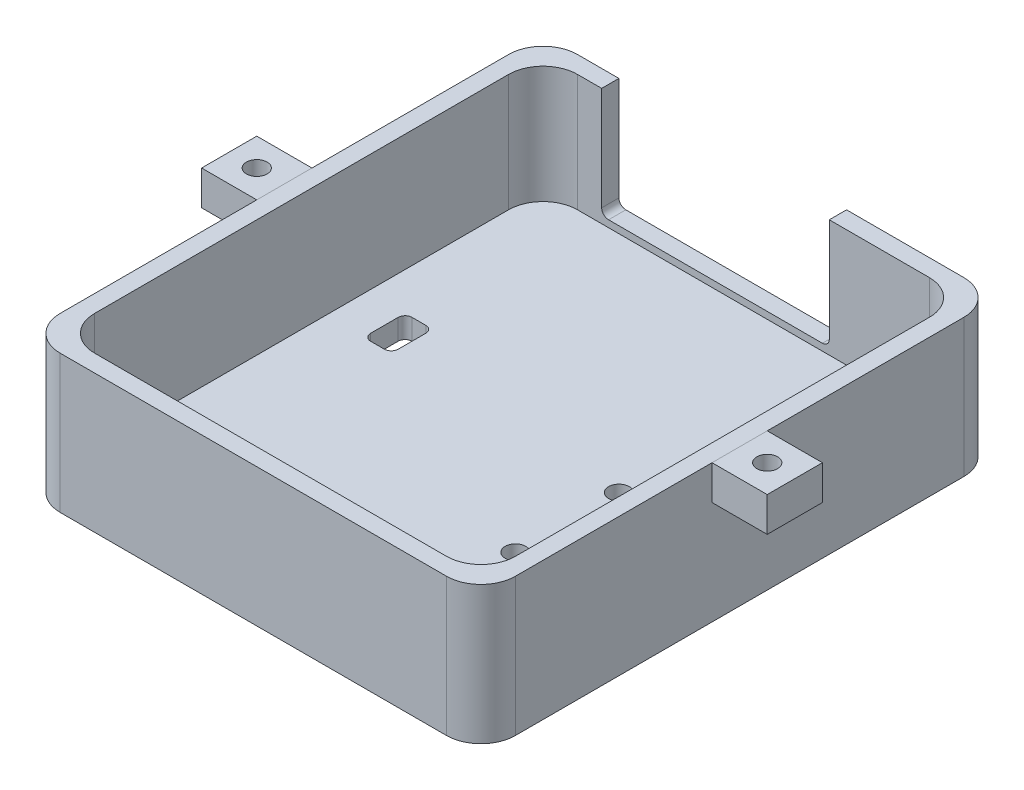
from build123d import *

# Parameters (mm, degrees)
AUFSATZ_LINEAR_AUSTRAGEN1_DEPTH   = 20
SCHNITT_LINEAR_AUSTRAGEN1_DEPTH   = 17
SCHNITT_LINEAR_AUSTRAGEN2_DEPTH   = 32
SCHNITT_LINEAR_AUSTRAGEN3_DEPTH   = 17
SKIZZE5_R                         = 1.5
SCHNITT_LINEAR_AUSTRAGEN4_DEPTH   = 17
SKIZZE7_W                         = 8
SKIZZE7_H                         = 8
AUFSATZ_LINEAR_AUSTRAGEN2_DEPTH   = 5
AUFSATZ_LINEAR_AUSTRAGEN2_2_DEPTH = 5
SKIZZE8_R                         = 1.5
SCHNITT_LINEAR_AUSTRAGEN6_DEPTH   = 10
SKIZZE9_R                         = 1.5
SCHNITT_LINEAR_AUSTRAGEN7_DEPTH   = 10


with BuildPart() as part:
    # Skizze1 → Aufsatz-Linear austragen1 (new body)
    with BuildSketch(Plane(origin=(0, 0, 0), x_dir=(1, 0, 0), z_dir=(0, 1, 0))):
        with BuildLine():
            Line((28, -37.5), (-28, -37.5))
            ThreePointArc((-28, -37.5), (-31.535533906, -36.035533906), (-33, -32.5))
            Line((-33, -32.5), (-33, 32.5))
            ThreePointArc((-33, 32.5), (-31.535533906, 36.035533906), (-28, 37.5))
            Line((-28, 37.5), (28, 37.5))
            ThreePointArc((28, 37.5), (31.535533906, 36.035533906), (33, 32.5))
            Line((33, 32.5), (33, -32.5))
            ThreePointArc((33, -32.5), (31.535533906, -36.035533906), (28, -37.5))
        make_face()
    extrude(amount=AUFSATZ_LINEAR_AUSTRAGEN1_DEPTH)

    # Skizze2 → Schnitt-Linear austragen1 (cut)
    with BuildSketch(Plane(origin=(0, 20, 0), x_dir=(1, 0, 0), z_dir=(0, 1, 0))):
        with BuildLine():
            Line((25.5, -35), (-25.5, -35))
            ThreePointArc((-25.5, -35), (-29.035533906, -33.535533906), (-30.5, -30))
            Line((-30.5, -30), (-30.5, 30))
            ThreePointArc((-30.5, 30), (-29.035533906, 33.535533906), (-25.5, 35))
            Line((-25.5, 35), (25.5, 35))
            ThreePointArc((25.5, 35), (29.035533906, 33.535533906), (30.5, 30))
            Line((30.5, 30), (30.5, -30))
            ThreePointArc((30.5, -30), (29.035533906, -33.535533906), (25.5, -35))
        make_face()
    extrude(amount=-SCHNITT_LINEAR_AUSTRAGEN1_DEPTH, mode=Mode.SUBTRACT)

    # Skizze3 → Schnitt-Linear austragen2 (cut)
    with BuildSketch(Plane(origin=(0, 0, -37.5), x_dir=(-1, 0, 0), z_dir=(0, 0, -1))):
        with BuildLine():
            Line((-10, 22), (21, 22))
            ThreePointArc((21, 22), (21.707106781, 21.707106781), (22, 21))
            Line((22, 21), (22, 5))
            ThreePointArc((22, 5), (21.707106781, 4.292893219), (21, 4))
            Line((21, 4), (-10, 4))
            ThreePointArc((-10, 4), (-10.707106781, 4.292893219), (-11, 5))
            Line((-11, 5), (-11, 21))
            ThreePointArc((-11, 21), (-10.707106781, 21.707106781), (-10, 22))
        make_face()
    extrude(amount=-SCHNITT_LINEAR_AUSTRAGEN2_DEPTH, mode=Mode.SUBTRACT)

    # Skizze4 → Schnitt-Linear austragen3 (cut)
    with BuildSketch(Plane.XZ):
        with BuildLine():
            Line((-22, -3.5), (-24, -3.5))
            ThreePointArc((-24, -3.5), (-24.707106781, -3.792893219), (-25, -4.5))
            Line((-25, -4.5), (-25, -8.5))
            ThreePointArc((-25, -8.5), (-24.707106781, -9.207106781), (-24, -9.5))
            Line((-24, -9.5), (-22, -9.5))
            ThreePointArc((-22, -9.5), (-21.292893219, -9.207106781), (-21, -8.5))
            Line((-21, -8.5), (-21, -4.5))
            ThreePointArc((-21, -4.5), (-21.292893219, -3.792893219), (-22, -3.5))
        make_face()
    extrude(amount=-SCHNITT_LINEAR_AUSTRAGEN3_DEPTH, mode=Mode.SUBTRACT)

    # Skizze5 → Schnitt-Linear austragen4 (cut)
    with BuildSketch(Plane.XZ):
        with Locations(Location((13, -2.5, 0), (0, 0, 270))):
            Circle(SKIZZE5_R)
        with Locations(Location((13, 27.5, 0), (0, 0, 270))):
            Circle(SKIZZE5_R)
        with Locations(Location((13, 12.5, 0), (0, 0, 270))):
            Circle(SKIZZE5_R)
    extrude(amount=-SCHNITT_LINEAR_AUSTRAGEN4_DEPTH, mode=Mode.SUBTRACT)


with BuildPart() as body_2:
    # Skizze7 → Aufsatz-Linear austragen2 (new body)
    with BuildSketch(Plane(origin=(0, 20, 0), x_dir=(1, 0, 0), z_dir=(0, 1, 0))):
        with Locations((37, 0)):
            Rectangle(SKIZZE7_W, SKIZZE7_H)
    extrude(amount=-AUFSATZ_LINEAR_AUSTRAGEN2_DEPTH)

    # Skizze9 → Schnitt-Linear austragen7 (cut)
    with BuildSketch(Plane(origin=(0, 20, 0), x_dir=(1, 0, 0), z_dir=(0, 1, 0))):
        with Locations(Location((37, 0, 0), (0, 0, 270))):
            Circle(SKIZZE9_R)
    extrude(amount=-SCHNITT_LINEAR_AUSTRAGEN7_DEPTH, mode=Mode.SUBTRACT)


with BuildPart() as body_3:
    # Skizze7 → Aufsatz-Linear austragen2 2 (new body)
    with BuildSketch(Plane(origin=(0, 20, 0), x_dir=(1, 0, 0), z_dir=(0, 1, 0))):
        with Locations((-37, 0)):
            Rectangle(SKIZZE7_W, SKIZZE7_H)
    extrude(amount=-AUFSATZ_LINEAR_AUSTRAGEN2_2_DEPTH)

    # Skizze8 → Schnitt-Linear austragen6 (cut)
    with BuildSketch(Plane(origin=(0, 20, 0), x_dir=(1, 0, 0), z_dir=(0, 1, 0))):
        with Locations(Location((-37, 0, 0), (0, 0, 270))):
            Circle(SKIZZE8_R)
    extrude(amount=-SCHNITT_LINEAR_AUSTRAGEN6_DEPTH, mode=Mode.SUBTRACT)


solid = Compound([part.part, body_2.part, body_3.part])
